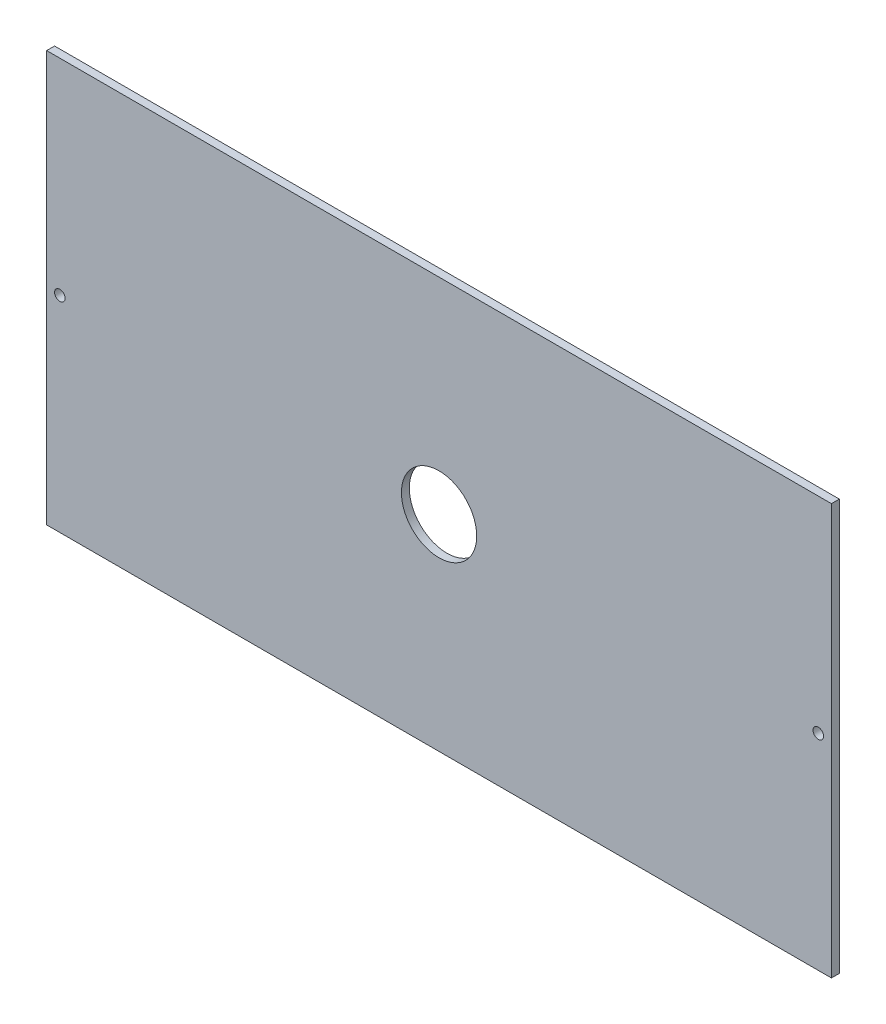
from build123d import *

# Parameters (mm, degrees)
SKETCH1_W           = 298
SKETCH1_H           = 156
SKETCH1_R           = 14.30543568
SKETCH1_R_2         = 2
BOSS_EXTRUDE2_DEPTH = 3


with BuildPart() as part:
    # Sketch1 → Boss-Extrude2 (new body)
    with BuildSketch(Plane.XY):
        with Locations((149, -78)):
            Rectangle(SKETCH1_W, SKETCH1_H)
        with Locations((149, -78)):
            Circle(SKETCH1_R, mode=Mode.SUBTRACT)
        with Locations((5, -78)):
            Circle(SKETCH1_R_2, mode=Mode.SUBTRACT)
        with Locations((293, -78)):
            Circle(SKETCH1_R_2, mode=Mode.SUBTRACT)
    extrude(amount=BOSS_EXTRUDE2_DEPTH)


solid = part.part
